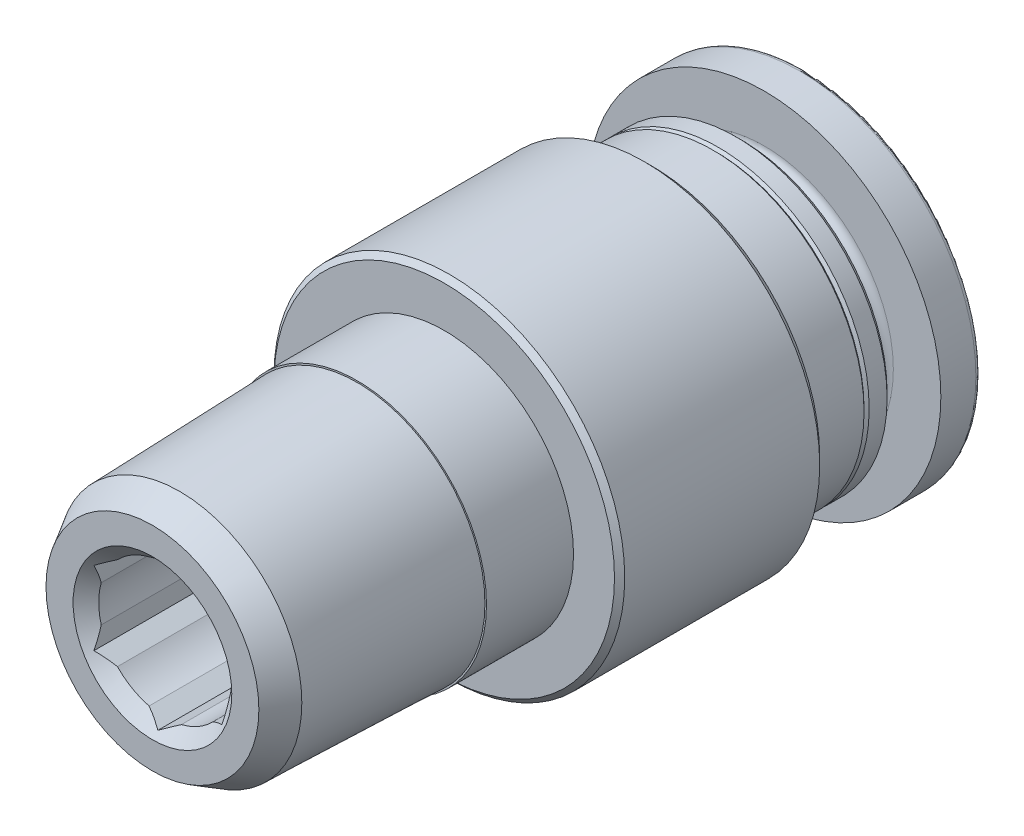
from build123d import *

# Parameters (mm, degrees)
CUT_EXTRUDE1_DEPTH = 7.7


with BuildPart() as part:
    # Sketch1 → Revolve1 (revolve)
    with BuildSketch(Plane(origin=(0, 0, 0), x_dir=(0, 0, -1), z_dir=(1, 0, 0)), mode=Mode.PRIVATE) as revolve1_sk:
        with BuildLine():
            Line((0, 0), (0, 6.85))
            Line((0, 6.85), (11.217157288, 6.85))
            Line((11.217157288, 6.85), (11.5, 6.567157288))
            Line((11.5, 6.567157288), (11.5, 5.9))
            Line((11.5, 5.9), (13.9, 5.9))
            Line((13.9, 5.9), (14, 5.8))
            Line((14, 5.8), (14.1, 5.9))
            Line((14.1, 5.9), (14.8, 5.9))
            Line((14.8, 5.9), (15, 5.7))
            Line((15, 5.7), (15, 4.669))
            Line((15, 4.669), (15.525, 4.669))
            ThreePointArc((15.525, 4.669), (15.790165043, 4.778834957), (15.9, 5.044))
            Line((15.9, 5.044), (15.9, 6.9))
            Line((15.9, 6.9), (17.268263788, 6.9))
            ThreePointArc((17.268263788, 6.9), (17.396821309, 6.853208889), (17.465225338, 6.734729636))
            Line((17.465225338, 6.734729636), (17.9, 4.269))
            Line((17.9, 4.269), (17.9, 0))
            Line((17.9, 0), (0, 0))
        make_face()
    revolve(revolve1_sk.sketch.rotate(Axis((0, 0, -17.9), (0, 0, 1)), 270), axis=Axis((0, 0, -17.9), (0, 0, 1)))

    # Sketch2 → Revolve2 (revolve)
    with BuildSketch(Plane(origin=(0, 0, 0), x_dir=(0, 0, -1), z_dir=(1, 0, 0)), mode=Mode.PRIVATE) as revolve2_sk:
        Polygon((-8, 0), (-8, 4.158121832), (-6.93615215, 4.772334675), (0, 4.988878168), (0, 0), align=None)
    revolve(revolve2_sk.sketch.rotate(Axis((0, 0, 0), (0, 0, 1)), 270), axis=Axis((0, 0, 0), (0, 0, 1)))

    # Sketch3 → Cut-Revolve1 (revolve, cut)
    with BuildSketch(Plane(origin=(0, 0, 0), x_dir=(0, 0, -1), z_dir=(1, 0, 0)), mode=Mode.PRIVATE) as cut_revolve1_sk:
        Polygon((0, 6.85), (0, 5.05), (3.4, 5.05), (3.4, 6.65), (3.6, 6.85), align=None)
    revolve(cut_revolve1_sk.sketch.rotate(Axis((0, 0, -50), (0, 0, 1)), 270), axis=Axis((0, 0, -50), (0, 0, 1)), mode=Mode.SUBTRACT)

    # Sketch4 → Cut-Revolve2 (revolve, cut)
    with BuildSketch(Plane(origin=(0, 0, 0), x_dir=(0, 0, -1), z_dir=(1, 0, 0)), mode=Mode.PRIVATE) as cut_revolve2_sk:
        with BuildLine():
            Line((-8, 0), (-8, 3.1))
            Line((-8, 3.1), (-7.5, 2.6))
            Line((-7.5, 2.6), (-0.3, 2.6))
            Line((-0.3, 2.6), (-0.3, 3.969))
            Line((-0.3, 3.969), (17.6, 3.969))
            ThreePointArc((17.6, 3.969), (17.812132034, 4.056867966), (17.9, 4.269))
            Line((17.9, 4.269), (17.9, 0))
            Line((17.9, 0), (-8, 0))
        make_face()
    revolve(cut_revolve2_sk.sketch.rotate(Axis((0, 0, -17.9), (0, 0, 1)), 270), axis=Axis((0, 0, -17.9), (0, 0, 1)), mode=Mode.SUBTRACT)

    # Sketch5 → Cut-Extrude1 (cut)
    with BuildSketch(Plane.XY.offset(0.3)):
        Polygon((-2.5, -1.443375673), (0, -2.886751346), (2.5, -1.443375673), (2.5, 1.443375673), (0, 2.886751346), (-2.5, 1.443375673), align=None)
    extrude(amount=CUT_EXTRUDE1_DEPTH, mode=Mode.SUBTRACT)


solid = part.part
